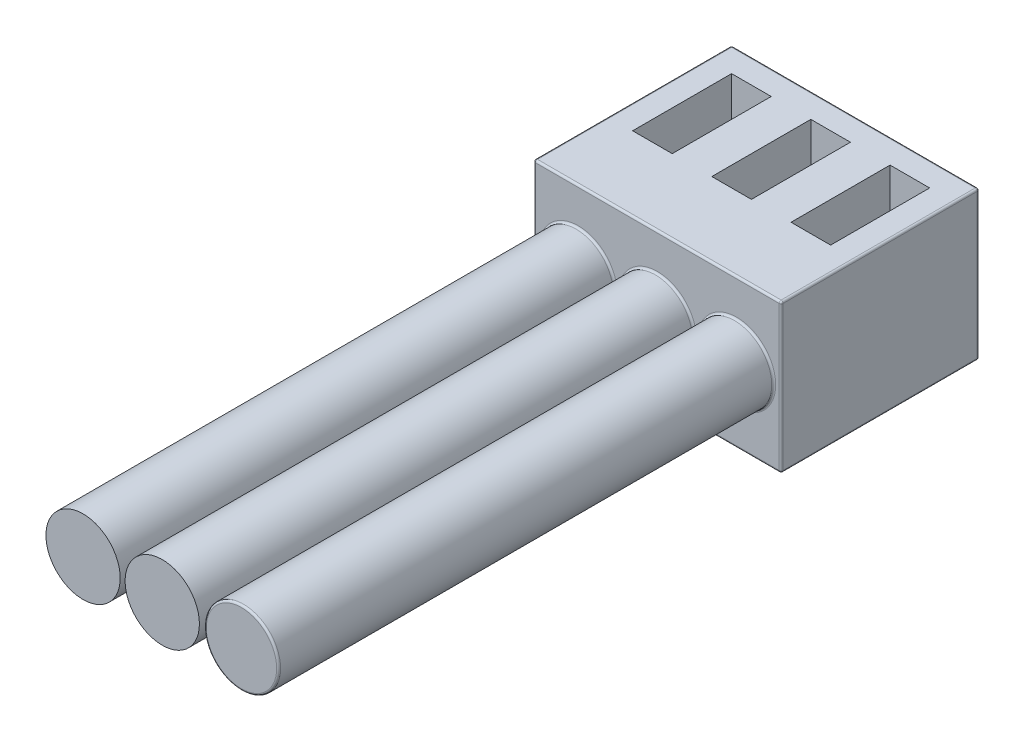
from build123d import *

# Parameters (mm, degrees)
SKETCH_1_W          = 5
SKETCH_1_H          = 3
EXTRUDE_1_DEPTH     = 4
SKETCH_2_R          = 0.75
EXTRUDE_5_DEPTH     = 10
SKETCH_4_W          = 0.8
SKETCH_4_H          = 2
CUT_EXTRUDE_1_DEPTH = 1
SKETCH_5_W          = 0.6
SKETCH_5_H          = 0.6
CUT_EXTRUDE_2_DEPTH = 2
FILLET_1_R          = 0.04


with BuildPart() as part:
    # 草圖1 → 填料-伸長1 (new body)
    with BuildSketch(Plane.XY):
        with Locations((0.05874417, -0.145833333)):
            Rectangle(SKETCH_1_W, SKETCH_1_H)
    extrude(amount=EXTRUDE_1_DEPTH)

    # 草圖2 → 填料-伸長5 (add)
    with BuildSketch(Plane.XY.offset(4)):
        with Locations((-1.54125583, -0.145833333)):
            Circle(SKETCH_2_R)
        with Locations((0.05874417, -0.145833333)):
            Circle(SKETCH_2_R)
        with Locations((1.65874417, -0.145833333)):
            Circle(SKETCH_2_R)
    extrude(amount=EXTRUDE_5_DEPTH)

    # 草圖4 → 除料-伸長1 (cut)
    with BuildSketch(Plane(origin=(0, 1.354166667, 0), x_dir=(1, 0, 0), z_dir=(0, 1, 0))):
        with Locations((1.65874417, -1.5)):
            Rectangle(SKETCH_4_W, SKETCH_4_H)
        with Locations((0.05874417, -1.5)):
            Rectangle(SKETCH_4_W, SKETCH_4_H)
        with Locations((-1.54125583, -1.5)):
            Rectangle(SKETCH_4_W, SKETCH_4_H)
    extrude(amount=-CUT_EXTRUDE_1_DEPTH, mode=Mode.SUBTRACT)

    # 草圖5 → 除料-伸長2 (cut)
    with BuildSketch(Plane(origin=(0, 0, 0), x_dir=(-1, 0, 0), z_dir=(0, 0, -1))):
        with Locations((-1.65874417, -0.145833333)):
            Rectangle(SKETCH_5_W, SKETCH_5_H)
        with Locations((-0.05874417, -0.145833333)):
            Rectangle(SKETCH_5_W, SKETCH_5_H)
        with Locations((1.54125583, -0.145833333)):
            Rectangle(SKETCH_5_W, SKETCH_5_H)
    extrude(amount=-CUT_EXTRUDE_2_DEPTH, mode=Mode.SUBTRACT)

    # 圓角1
    fillet_1_edges = [part.edges().sort_by_distance(p)[0] for p in [
        (2.55874417, -0.145833333, 4),
        (0.05874417, 1.354166667, 4),
        (-2.29125583, -0.145833333, 4),
        (-0.69125583, -0.145833333, 4),
        (0.90874417, -0.145833333, 4),
        (0.90874417, -0.145833333, 14),
        (-2.44125583, -0.145833333, 4),
        (0.05874417, 1.354166667, 0),
        (2.55874417, -0.145833333, 0),
        (0.05874417, -1.645833333, 0),
        (-2.44125583, -0.145833333, 0),
        (0.05874417, -1.645833333, 4),
        (-2.44125583, 1.354166667, 2),
        (2.55874417, 1.354166667, 2),
        (2.55874417, -1.645833333, 2),
        (-2.44125583, -1.645833333, 2),
    ]]
    fillet(fillet_1_edges, radius=FILLET_1_R)


solid = part.part
